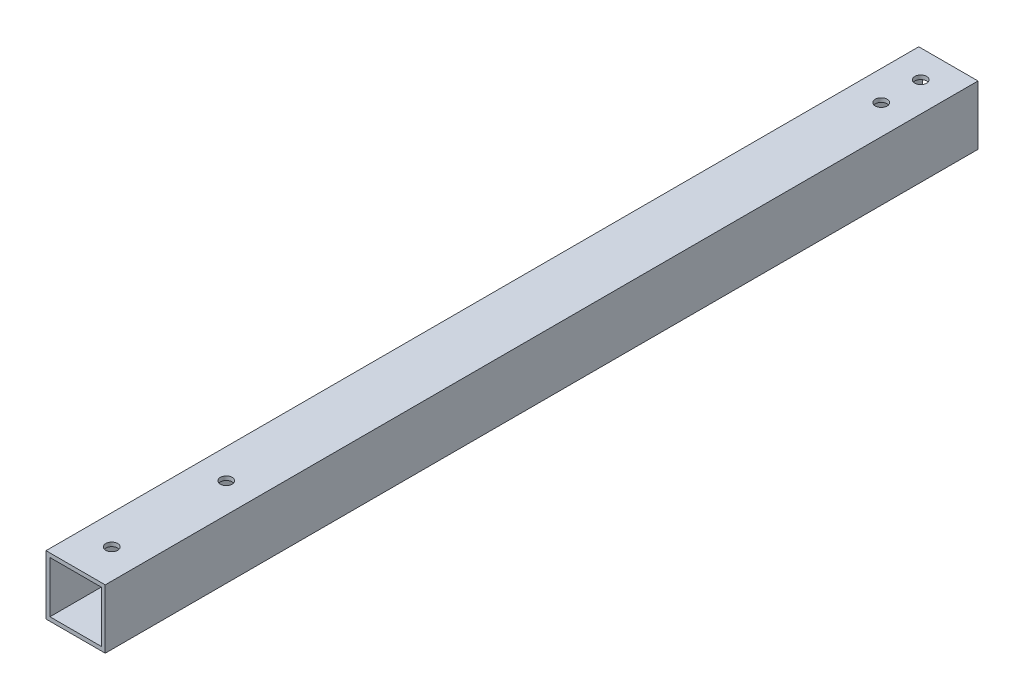
from build123d import *

# Parameters (mm, degrees)
SKETCH1_W           = 15
SKETCH1_H           = 15
SKETCH1_W_2         = 13
SKETCH1_H_2         = 13
BOSS_EXTRUDE1_DEPTH = 221
SKETCH4_R           = 1.5
CUT_EXTRUDE1_DEPTH  = 26
SKETCH5_R           = 1.5
CUT_EXTRUDE2_DEPTH  = 34


with BuildPart() as part:
    # Sketch1 → Boss-Extrude1 (new body)
    with BuildSketch(Plane.XY):
        Rectangle(SKETCH1_W, SKETCH1_H)
        Rectangle(SKETCH1_W_2, SKETCH1_H_2, mode=Mode.SUBTRACT)
    extrude(amount=BOSS_EXTRUDE1_DEPTH)

    # Sketch4 → Cut-Extrude1 (cut)
    with BuildSketch(Plane(origin=(0, 7.5, 0), x_dir=(1, 0, 0), z_dir=(0, 1, 0))):
        with Locations((0, -7)):
            Circle(SKETCH4_R)
        with Locations((0, -17)):
            Circle(SKETCH4_R)
    extrude(amount=-CUT_EXTRUDE1_DEPTH, mode=Mode.SUBTRACT)

    # Sketch5 → Cut-Extrude2 (cut)
    with BuildSketch(Plane(origin=(0, 7.5, 0), x_dir=(1, 0, 0), z_dir=(0, 1, 0))):
        with Locations((0, -182.85171377)):
            Circle(SKETCH5_R)
        with Locations((0, -211.85171377)):
            Circle(SKETCH5_R)
    extrude(amount=-CUT_EXTRUDE2_DEPTH, mode=Mode.SUBTRACT)


solid = part.part
